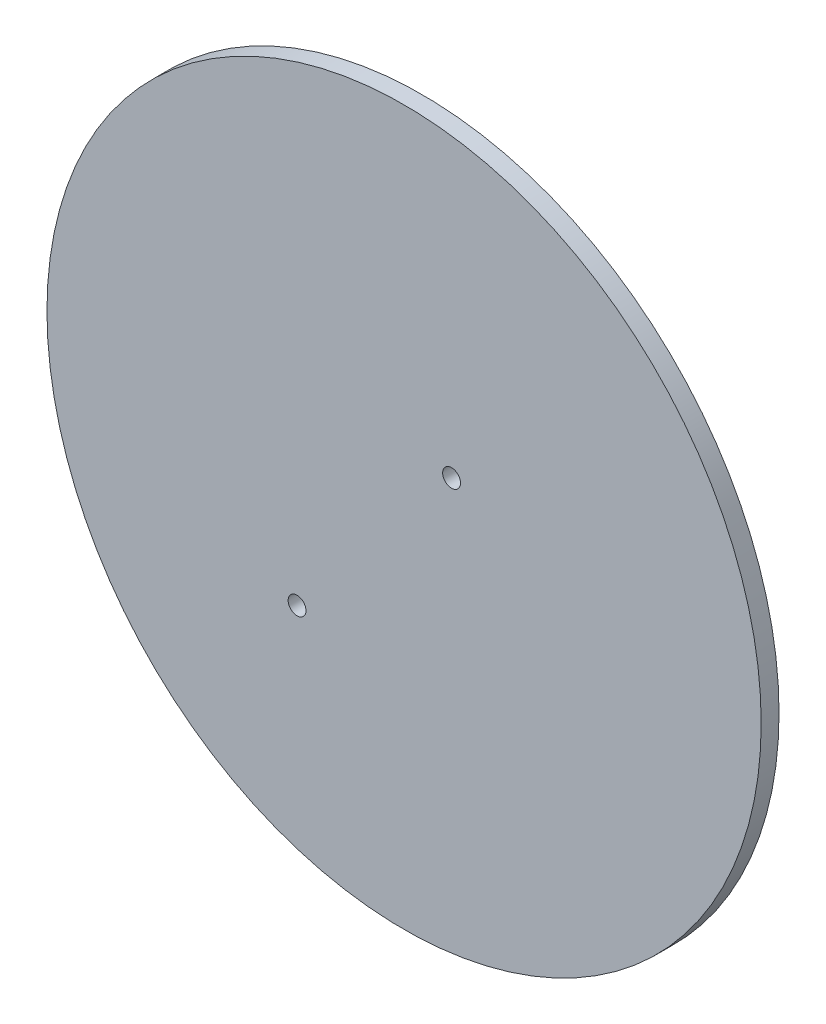
from build123d import *

# Parameters (mm, degrees)
SKETCH1_R           = 40.024233707
SKETCH1_R_2         = 1
BOSS_EXTRUDE1_DEPTH = 2


with BuildPart() as part:
    # Sketch1 → Boss-Extrude1 (new body)
    with BuildSketch(Plane.XY):
        Circle(SKETCH1_R)
        with Locations((5.322062489, 6.466550538)):
            Circle(SKETCH1_R_2, mode=Mode.SUBTRACT)
        with Locations((-11.994499043, -14.57386763)):
            Circle(SKETCH1_R_2, mode=Mode.SUBTRACT)
    extrude(amount=BOSS_EXTRUDE1_DEPTH)


solid = part.part
